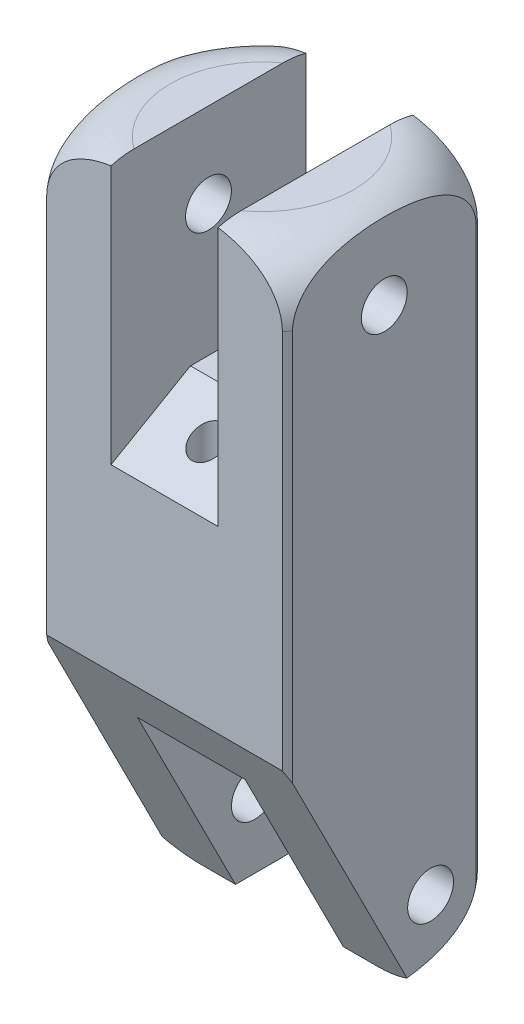
from build123d import *

# Parameters (mm, degrees)
SKETCH1_R           = 10
EXTRUDE1_DEPTH      = 45
FILLET1_R           = 4
SKETCH2_W           = 7.044053374
SKETCH2_H           = 25.342236328
SKETCH2_W_2         = 7
SKETCH2_H_2         = 23.94716261
EXTRUDE2_DEPTH      = 20
SKETCH5_W           = 5.258419436
SKETCH5_H           = 20.959398048
EXTRUDE4_DEPTH      = 48.169905777
SKETCH11_W          = 21.968744981
SKETCH11_H          = 5.630856805
EXTRUDE10_DEPTH     = 47.786750374
SKETCH12_R          = 1.5
EXTRUDE11_DEPTH     = 49.183163121
SKETCH13_R          = 1.5
EXTRUDE12_DEPTH     = 49.183163121
CHAMFER_1_SIZE      = 3
CHAMFER_1_SIZE2     = 5.196152423
SKETCH_1_R          = 1
CUT_EXTRUDE_1_DEPTH = 34.908314691


with BuildPart() as part:
    # Sketch1 → Extrude1 (new body)
    with BuildSketch(Plane(origin=(0, 0, 0), x_dir=(1, 0, 0), z_dir=(0, 1, 0))):
        with Locations(Location((0, 0, 0), (0, 0, 90))):
            Circle(SKETCH1_R)
    extrude(amount=EXTRUDE1_DEPTH)

    # Fillet1
    fillet1_edges = [part.edges().sort_by_distance(p)[0] for p in [
        (0, 0, 10),
        (0, 45, 10),
    ]]
    fillet(fillet1_edges, radius=FILLET1_R)

    # Sketch2 → Extrude2 (cut, symmetric)
    with BuildSketch(Plane.XY):
        Rectangle(SKETCH2_W, SKETCH2_H)
        with Locations((0, 42.838233159)):
            Rectangle(SKETCH2_W_2, SKETCH2_H_2)
    extrude(amount=EXTRUDE2_DEPTH, both=True, mode=Mode.SUBTRACT)

    # Sketch5 → Extrude4 (cut, through all)
    with BuildSketch(Plane(origin=(0, 0, 0), x_dir=(1, 0, 0), z_dir=(0, 1, 0))):
        with Locations((10.629209718, 0.450601309)):
            Rectangle(SKETCH5_W, SKETCH5_H)
        with Locations((-10.629209718, 0.450601309)):
            Rectangle(SKETCH5_W, SKETCH5_H)
    extrude(amount=EXTRUDE4_DEPTH, mode=Mode.SUBTRACT)

    # Sketch11 → Extrude10 (cut, through all)
    with BuildSketch(Plane(origin=(0, 45, 0), x_dir=(1, 0, 0), z_dir=(0, 1, 0))):
        with Locations((-0.154491877, -9.18859048)):
            Rectangle(SKETCH11_W, SKETCH11_H)
        with Locations((-0.154491877, 9.18859048)):
            Rectangle(SKETCH11_W, SKETCH11_H)
    extrude(amount=-EXTRUDE10_DEPTH, mode=Mode.SUBTRACT)

    # Sketch12 → Extrude11 (cut, through all)
    with BuildSketch(Plane.ZY.offset(8)):
        with Locations(Location((0, 39.462335046, 0), (0, 0, 180))):
            Circle(SKETCH12_R)
    extrude(amount=-EXTRUDE11_DEPTH, mode=Mode.SUBTRACT)

    # Sketch13 → Extrude12 (cut, through all)
    with BuildSketch(Plane.ZY.offset(8)):
        with Locations(Location((-3.026564036, 4.561005479, 0), (0, 0, 180))):
            Circle(SKETCH13_R)
        Polygon((6.818378582, 17.003077145), (-1.791354285, 0), (6.818378582, 0), align=None)
    extrude(amount=-EXTRUDE12_DEPTH, mode=Mode.SUBTRACT)

    # Фаска1
    chamfer_1_edges = [part.edges().sort_by_distance(p)[0] for p in [
        (0, 30.864651854, 6.373162077),
    ]]
    chamfer_1_side = [part.faces().sort_by_distance(p)[0] for p in [
        (0, 28.01207475, 6.373162077),
    ]]
    chamfer(chamfer_1_edges, length=CHAMFER_1_SIZE, length2=CHAMFER_1_SIZE2, reference=chamfer_1_side[0])

    # Эскиз1 → Вырез-Вытянуть1 (cut, through all)
    with BuildSketch(Plane.XZ.offset(-12.671118164)):
        with Locations(Location((-0.022026687, 3.547657951, 0), (0, 0, 270))):
            Circle(SKETCH_1_R)
    extrude(amount=-CUT_EXTRUDE_1_DEPTH, mode=Mode.SUBTRACT)


solid = part.part
